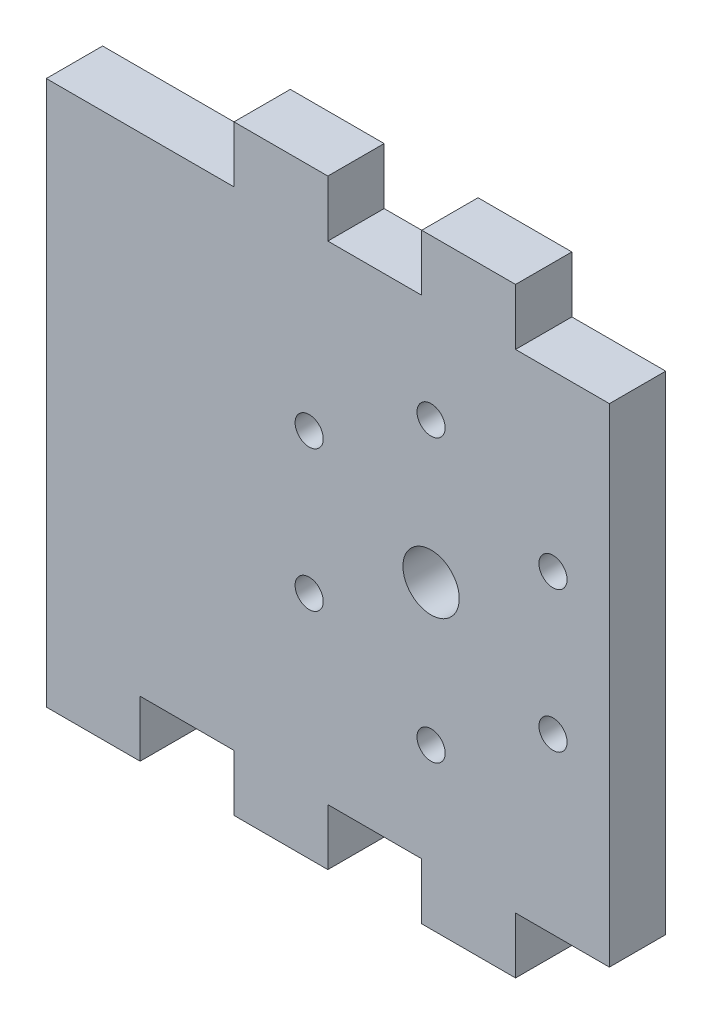
from build123d import *

# Parameters (mm, degrees)
SKETCH1_R           = 0.75
SKETCH1_R_2         = 1.5
BOSS_EXTRUDE1_DEPTH = 3


with BuildPart() as part:
    # Sketch1 → Boss-Extrude1 (new body)
    with BuildSketch(Plane.XY):
        Polygon((10, 0), (10, 3), (15, 3), (15, 0), (20, 0), (20, 3), (25, 3), (25, 0), (30, 0), (30, -26), (25, -26), (25, -29), (20, -29), (20, -26), (15, -26), (15, -29), (10, -29), (10, -26), (5, -26), (5, -29), (0, -29), (0, 0), align=None)
        with Locations((20.5, -5.5)):
            Circle(SKETCH1_R, mode=Mode.SUBTRACT)
        with Locations((26.995190528, -9.25)):
            Circle(SKETCH1_R, mode=Mode.SUBTRACT)
        with Locations((26.995190528, -16.75)):
            Circle(SKETCH1_R, mode=Mode.SUBTRACT)
        with Locations((20.5, -20.5)):
            Circle(SKETCH1_R, mode=Mode.SUBTRACT)
        with Locations((14.004809472, -16.75)):
            Circle(SKETCH1_R, mode=Mode.SUBTRACT)
        with Locations((14.004809472, -9.25)):
            Circle(SKETCH1_R, mode=Mode.SUBTRACT)
        with Locations((20.5, -13)):
            Circle(SKETCH1_R_2, mode=Mode.SUBTRACT)
    extrude(amount=BOSS_EXTRUDE1_DEPTH)


solid = part.part
